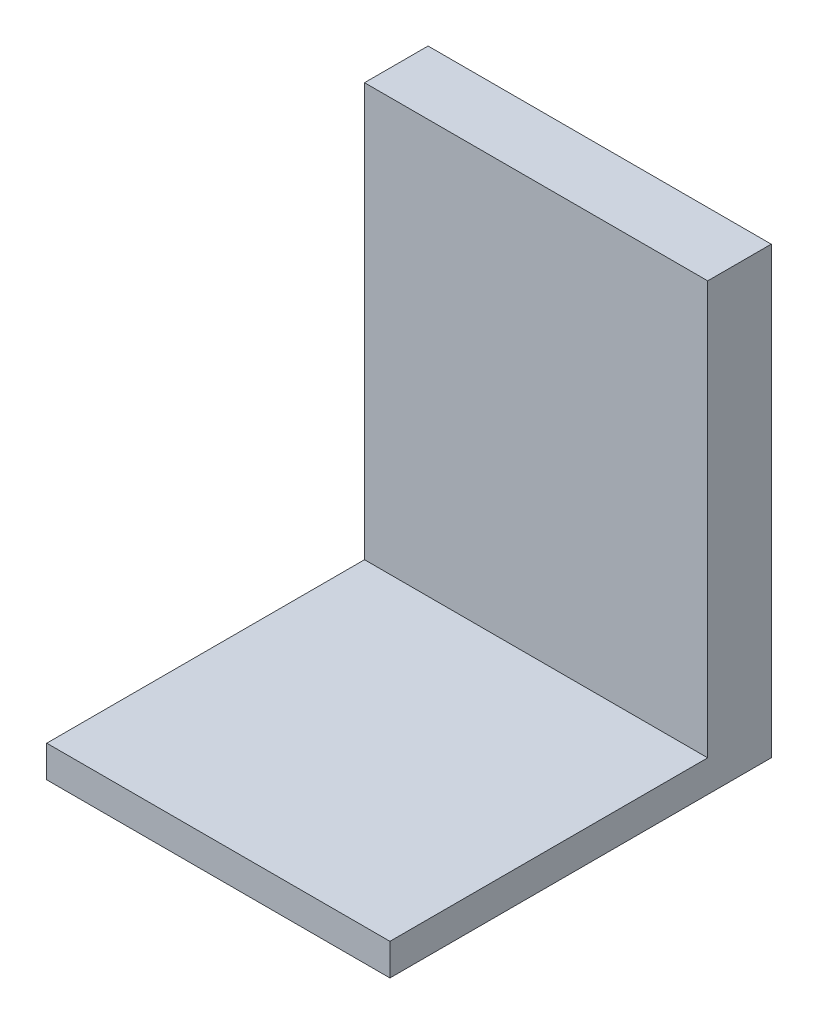
from build123d import *

# Parameters (mm, degrees)
SKETCH1_W                      = 670
SKETCH1_H                      = 120
BOSS_EXTRUDE1_DEPTH            = 530
SKETCH2_W                      = 100
SKETCH2_H                      = 200
SKETCH2_W_2                    = 650
SKETCH2_H_2                    = 250
CUT_EXTRUDE1_DEPTH             = 100
SKETCH3_R                      = 50
CUT_EXTRUDE2_DEPTH             = 260
F_12_0_12_DIAMETER_HOLE2_D     = 12
F_12_0_12_DIAMETER_HOLE2_DEPTH = 30
F_12_0_12_DIAMETER_HOLE2_TIP   = 3.605163714
SKETCH8_W                      = 650
SKETCH8_H                      = 50
BOSS_EXTRUDE2_DEPTH            = 5
SKETCH9_W                      = 10
SKETCH9_H                      = 250
CUT_EXTRUDE3_DEPTH             = 717
CUT_EXTRUDE4_DEPTH             = 5
SKETCH11_W                     = 10
SKETCH11_H                     = 100
BOSS_EXTRUDE3_DEPTH            = 78
BOSS_EXTRUDE3_2_DEPTH          = 78
BOSS_EXTRUDE3_3_DEPTH          = 78
SKETCH12_W                     = 20
SKETCH12_H                     = 30
CUT_EXTRUDE5_DEPTH             = 80
SKETCH15_W                     = 30
SKETCH15_H                     = 23.536156656
SKETCH15_H_2                   = 28.986603691
CUT_EXTRUDE7_DEPTH             = 35
SHELL1_T                       = -3
SKETCH16_W                     = 14
SKETCH16_H                     = 14
CUT_EXTRUDE8_DEPTH             = 35
SKETCH17_W                     = 5.729882812
SKETCH17_H                     = 17.428393554
SKETCH17_W_2                   = 13.369726562
SKETCH17_H_2                   = 3.342431641
BOSS_EXTRUDE4_DEPTH            = 5
CUT_EXTRUDE10_DEPTH            = 863.670273187
CUT_EXTRUDE10_DEPTH_BACK       = 863.670273187
SKETCH18_W                     = 670
SKETCH18_H                     = 250
CUT_EXTRUDE12_DEPTH            = 734.007503372
CUT_EXTRUDE12_DEPTH_BACK       = 734.007503372
SKETCH19_W                     = 440
SKETCH19_H                     = 280
SKETCH20_W                     = 210.918945895
SKETCH20_H                     = 296.400973443
CUT_EXTRUDE14_DEPTH            = 156
CUT_EXTRUDE15_DEPTH            = 376.898922584
CUT_EXTRUDE15_DEPTH_BACK       = 376.898922584
SKETCH21_W                     = 108
SKETCH21_H                     = 140


with BuildPart() as part:
    # Sketch1 → Boss-Extrude1 (new body)
    with BuildSketch(Plane(origin=(0, 0, 0), x_dir=(1, 0, 0), z_dir=(0, 1, 0))):
        with Locations((335, 60)):
            Rectangle(SKETCH1_W, SKETCH1_H)
    extrude(amount=BOSS_EXTRUDE1_DEPTH)

    # Sketch2 → Cut-Extrude1 (cut)
    with BuildSketch(Plane.XY):
        with Locations((60, 380)):
            Rectangle(SKETCH2_W, SKETCH2_H)
        with Locations((170, 380)):
            Rectangle(SKETCH2_W, SKETCH2_H)
        with Locations((280, 380)):
            Rectangle(SKETCH2_W, SKETCH2_H)
        with Locations((390, 380)):
            Rectangle(SKETCH2_W, SKETCH2_H)
        with Locations((500, 380)):
            Rectangle(SKETCH2_W, SKETCH2_H)
        with Locations((610, 380)):
            Rectangle(SKETCH2_W, SKETCH2_H)
        with Locations((335, 135)):
            Rectangle(SKETCH2_W_2, SKETCH2_H_2)
    extrude(amount=-CUT_EXTRUDE1_DEPTH, mode=Mode.SUBTRACT)

    # Sketch3 → Cut-Extrude2 (cut)
    with BuildSketch(Plane(origin=(0, 530, 0), x_dir=(1, 0, 0), z_dir=(0, 1, 0))):
        with Locations(Location((60, 60, 0), (0, 0, 270))):
            Circle(SKETCH3_R)
        with Locations(Location((170, 60, 0), (0, 0, 270))):
            Circle(SKETCH3_R)
        with Locations(Location((280, 60, 0), (0, 0, 270))):
            Circle(SKETCH3_R)
        with Locations(Location((390, 60, 0), (0, 0, 270))):
            Circle(SKETCH3_R)
        with Locations(Location((500, 60, 0), (0, 0, 270))):
            Circle(SKETCH3_R)
        with Locations(Location((610, 60, 0), (0, 0, 270))):
            Circle(SKETCH3_R)
    extrude(amount=-CUT_EXTRUDE2_DEPTH, mode=Mode.SUBTRACT)

    # Ø12.0 (12) Diameter Hole2
    with Locations(Plane(origin=(59.704642413, 270, -102.411697903), x_dir=(0, 0, 1), z_dir=(0, 1, 0))):
        with Locations((0, 0), (-0.195888006, 111.8520513), (0.014838595, 221.167624818), (-0.341843303, 331.364008353), (0.657723149, 441.008646429), (1.288998006, 549.811854685)):
            Hole(F_12_0_12_DIAMETER_HOLE2_D / 2, depth=F_12_0_12_DIAMETER_HOLE2_DEPTH)
            with Locations((0, 0, -(F_12_0_12_DIAMETER_HOLE2_DEPTH + F_12_0_12_DIAMETER_HOLE2_TIP / 2))):  # 118° drill point
                Cone(0, F_12_0_12_DIAMETER_HOLE2_D / 2, F_12_0_12_DIAMETER_HOLE2_TIP, mode=Mode.SUBTRACT)

    # Sketch8 → Boss-Extrude2 (add)
    with BuildSketch(Plane.XY):
        with Locations((335, 305)):
            Rectangle(SKETCH8_W, SKETCH8_H)
    extrude(amount=-BOSS_EXTRUDE2_DEPTH)

    # Sketch9 → Cut-Extrude3 (cut)
    with BuildSketch(Plane(origin=(670, 0, 0), x_dir=(0, 0, -1), z_dir=(1, 0, 0))):
        with Locations((15, 135)):
            Rectangle(SKETCH9_W, SKETCH9_H)
    extrude(amount=-CUT_EXTRUDE3_DEPTH, mode=Mode.SUBTRACT)

    # Sketch10 → Cut-Extrude4 (cut)
    with BuildSketch(Plane(origin=(0, 10, 0), x_dir=(1, 0, 0), z_dir=(0, 1, 0))):
        Polygon((365, 61.943560596), (350, 87.924322709), (320, 87.924322709), (305, 61.943560596), (320, 35.962798482), (350, 35.962798482), align=None)
    extrude(amount=-CUT_EXTRUDE4_DEPTH, mode=Mode.SUBTRACT)

    # Sketch12 → Cut-Extrude5 (cut)
    with BuildSketch(Plane.XY.offset(-100)):
        with Locations((85.198613037, 245)):
            Rectangle(SKETCH12_W, SKETCH12_H)
        with Locations((195.198613037, 245)):
            Rectangle(SKETCH12_W, SKETCH12_H)
        with Locations((305.198613037, 245)):
            Rectangle(SKETCH12_W, SKETCH12_H)
        with Locations((415.198613037, 245)):
            Rectangle(SKETCH12_W, SKETCH12_H)
        with Locations((525.198613037, 245)):
            Rectangle(SKETCH12_W, SKETCH12_H)
        with Locations((635.198613037, 245)):
            Rectangle(SKETCH12_W, SKETCH12_H)
    extrude(amount=-CUT_EXTRUDE5_DEPTH, mode=Mode.SUBTRACT)

    # Sketch17 → Boss-Extrude4 (add)
    # profile 1 of 9: a face of its own
    with BuildSketch(Plane.XY):
        with BuildLine():
            Line((527.508830928, 289.835452458), (527.508830928, 307.263846012))
            Line((527.508830928, 307.263846012), (534.861434459, 307.263846012))
            add(Edge.make_bspline(
                [(534.861434459, 307.263846012), (535.181337774, 307.258256848), (535.803061116, 307.24739446), (536.703508491, 307.139069344), (537.544992916, 306.975202489), (538.325061607, 306.737496792), (539.040841948, 306.426020155), (539.698044515, 306.051894954), (540.290333057, 305.605079277), (540.822348212, 305.090232636), (541.284521701, 304.502523111), (541.692171296, 303.852565801), (542.030284458, 303.129762281), (542.309377095, 302.341316546), (542.5243908, 301.484161689), (542.679660381, 300.560045938), (542.773357357, 299.567500804), (542.783368073, 298.883107022), (542.788518428, 298.530997273)],
                knots=[0, 0, 0, 0, 1.135059408, 2.20595691, 3.214417064, 4.174978569, 5.094187092, 5.980001006, 6.853065862, 7.720814779, 8.600404634, 9.50058483, 10.438414914, 11.426825708, 12.465239141, 13.571113463, 14.750376389, 16, 16, 16, 16], degree=3))
            add(Edge.make_bspline(
                [(542.788518428, 298.530997273), (542.781740751, 298.180151665), (542.768592871, 297.499553336), (542.676885992, 296.511518461), (542.516733301, 295.591080531), (542.296748778, 294.736450427), (542.003051046, 293.953120444), (541.654236167, 293.233205539), (541.233025793, 292.585291498), (540.753136904, 292.000029304), (540.204772188, 291.484681411), (539.587651059, 291.044279297), (538.910779309, 290.668464036), (538.169670382, 290.361903209), (537.364073889, 290.124869172), (536.495133477, 289.954199984), (535.562644449, 289.853487388), (534.920131033, 289.841584621), (534.58911581, 289.835452458)],
                knots=[0, 0, 0, 0, 1.228418252, 2.382983832, 3.470276728, 4.496757894, 5.468023682, 6.394867725, 7.292157164, 8.167372942, 9.039072913, 9.918728341, 10.815246345, 11.744296628, 12.720973084, 13.750736166, 14.841206188, 16, 16, 16, 16], degree=3))
            Line((534.58911581, 289.835452458), (527.508830928, 289.835452458))
        make_face()
        with BuildLine():
            Line((533.238713741, 291.745413395), (534.048208904, 291.745413395))
            add(Edge.make_bspline(
                [(534.048208904, 291.745413395), (534.172894012, 291.749291978), (534.413033311, 291.756761998), (534.758676231, 291.825976613), (535.075745017, 291.938271137), (535.365749176, 292.094802589), (535.623404602, 292.300450923), (535.848862806, 292.551404902), (536.04776914, 292.844737637), (536.217685755, 293.190205032), (536.364284647, 293.596533622), (536.481764702, 294.076367921), (536.592118304, 294.630928744), (536.673672739, 295.265507643), (536.740044562, 295.978448886), (536.788346679, 296.768428292), (536.812018936, 297.636801208), (536.817188964, 298.241258393), (536.819890499, 298.55711002)],
                knots=[0, 0, 0, 0, 0.728710832, 1.403472396, 2.052289494, 2.690292559, 3.321919393, 3.970736491, 4.656696891, 5.388631723, 6.217040872, 7.17856157, 8.275589967, 9.523440737, 10.918935818, 12.463926104, 14.152268318, 16, 16, 16, 16], degree=3))
            add(Edge.make_bspline(
                [(536.819890499, 298.55711002), (536.8171426, 298.871715251), (536.811863063, 299.476166083), (536.7886758, 300.343334385), (536.739579947, 301.133216935), (536.674703848, 301.843934916), (536.589660404, 302.476324031), (536.488366458, 303.031681737), (536.362441588, 303.507627045), (536.222158727, 303.914921549), (536.050140993, 304.256514038), (535.858357073, 304.554097881), (535.62547107, 304.79746827), (535.36991257, 305.004888479), (535.079348843, 305.160875844), (534.761320266, 305.273944358), (534.414185903, 305.34216807), (534.172870641, 305.349893944), (534.048208904, 305.353885075)],
                knots=[0, 0, 0, 0, 1.842836665, 3.540640921, 5.080358154, 6.47765669, 7.719902824, 8.816971715, 9.781579111, 10.601733135, 11.334613876, 12.017393917, 12.666641099, 13.29908421, 13.937911793, 14.587567384, 15.270347425, 16, 16, 16, 16], degree=3))
            Line((534.048208904, 305.353885075), (533.238713741, 305.353885075))
            Line((533.238713741, 305.353885075), (533.238713741, 291.745413395))
        make_face(mode=Mode.SUBTRACT)
    # profile 2 of 9: a face of its own
    with BuildSketch(Plane.XY):
        with Locations((547.563420772, 298.549649235)):
            Rectangle(SKETCH17_W, SKETCH17_H)
    # profile 3 of 9: a face of its own
    with BuildSketch(Plane.XY):
        Polygon((564.514324092, 307.263846012), (564.514324092, 305.115139958), (558.545696163, 305.115139958), (558.545696163, 299.862747379), (563.559343624, 299.862747379), (563.559343624, 297.714041325), (558.545696163, 297.714041325), (558.545696163, 289.835452458), (552.81581335, 289.835452458), (552.81581335, 307.263846012), align=None)
    # profile 4 of 9: a face of its own
    with BuildSketch(Plane.XY):
        Polygon((577.645305538, 307.263846012), (577.645305538, 305.115139958), (571.676677608, 305.115139958), (571.676677608, 299.862747379), (576.690325069, 299.862747379), (576.690325069, 297.714041325), (571.676677608, 297.714041325), (571.676677608, 289.835452458), (565.946794795, 289.835452458), (565.946794795, 307.263846012), align=None)
    # profile 5 of 9: a face of its own
    with BuildSketch(Plane.XY):
        with Locations((584.330168819, 287.448001286)):
            Rectangle(SKETCH17_W_2, SKETCH17_H_2)
    # profile 6 of 9: a face of its own
    with BuildSketch(Plane.XY):
        with BuildLine():
            Line((605.578484249, 307.263846012), (605.578484249, 295.602639195))
            add(Edge.make_bspline(
                [(605.578484249, 295.602639195), (605.574209777, 295.35989389), (605.565919345, 294.889083964), (605.480877158, 294.20653885), (605.349958188, 293.569747554), (605.15926554, 292.978838165), (604.911867049, 292.436847071), (604.616163877, 291.936663973), (604.260702644, 291.487723021), (603.847299908, 291.08966617), (603.386881991, 290.731670113), (602.867295001, 290.425440037), (602.293741958, 290.168488385), (601.66690529, 289.960990771), (600.988052682, 289.797299786), (600.254912883, 289.679078851), (599.467035781, 289.60781007), (598.923618241, 289.60048219), (598.643684673, 289.59670734)],
                knots=[0, 0, 0, 0, 1.108173197, 2.149326602, 3.136215123, 4.073726706, 4.978516626, 5.852185058, 6.72141202, 7.584905625, 8.467554395, 9.379216169, 10.332422268, 11.332766067, 12.390653242, 13.518530507, 14.721707419, 16, 16, 16, 16], degree=3))
            add(Edge.make_bspline(
                [(598.643684673, 289.59670734), (598.373688491, 289.600411437), (597.851346557, 289.607577482), (597.093280473, 289.679448684), (596.387523889, 289.797736542), (595.733050135, 289.960122315), (595.130189942, 290.169220301), (594.579048171, 290.42623041), (594.078350789, 290.732835498), (593.633858028, 291.090104794), (593.234289459, 291.486851767), (592.899913678, 291.940746827), (592.609043638, 292.435866034), (592.375223767, 292.980322997), (592.191754821, 293.570441519), (592.063541006, 294.20666921), (591.983676196, 294.889343196), (591.974661767, 295.359932437), (591.970012569, 295.602639195)],
                knots=[0, 0, 0, 0, 1.258901956, 2.435505865, 3.547148904, 4.59359074, 5.576649289, 6.5183682, 7.424469602, 8.307507093, 9.172751023, 10.042627298, 10.928839176, 11.845659241, 12.799442865, 13.80597989, 14.868432463, 16, 16, 16, 16], degree=3))
            Line((591.970012569, 295.602639195), (591.970012569, 307.263846012))
            Line((591.970012569, 307.263846012), (597.699895381, 307.263846012))
            Line((597.699895381, 307.263846012), (597.699895381, 295.457153889))
            add(Edge.make_bspline(
                [(597.699895381, 295.457153889), (597.700816195, 295.287996189), (597.702584578, 294.963135903), (597.729908723, 294.499051493), (597.768241004, 294.079064133), (597.828226169, 293.705517832), (597.90066041, 293.377063412), (597.989882091, 293.09281535), (598.094998068, 292.852496478), (598.225239063, 292.654232043), (598.380826623, 292.495135011), (598.55368342, 292.353231761), (598.757556996, 292.238543846), (598.987648905, 292.146224908), (599.243380948, 292.070549638), (599.526120553, 292.020376099), (599.83553351, 291.990763905), (600.049971942, 291.986424568), (600.161954402, 291.984158512)],
                knots=[0, 0, 0, 0, 1.622370975, 3.115695595, 4.458049099, 5.666011203, 6.742434742, 7.681714947, 8.519814998, 9.250928664, 9.942747364, 10.646898194, 11.389596108, 12.175933929, 13.021386247, 13.943159715, 14.925891993, 16, 16, 16, 16], degree=3))
            add(Edge.make_bspline(
                [(600.161954402, 291.984158512), (600.283927219, 291.987190593), (600.521124756, 291.993087005), (600.86597014, 292.03390861), (601.187714881, 292.103380086), (601.484890424, 292.205377303), (601.758665297, 292.332852529), (602.012761516, 292.484567923), (602.236391413, 292.674631152), (602.439076761, 292.888441291), (602.620738276, 293.128529789), (602.771757722, 293.399928575), (602.905501548, 293.697121508), (603.005823683, 294.025060118), (603.089837826, 294.379999499), (603.146989706, 294.763086929), (603.186210275, 295.174074524), (603.189394751, 295.457053988), (603.191033077, 295.602639195)],
                knots=[0, 0, 0, 0, 1.083870311, 2.107775948, 3.08105344, 4.003637981, 4.893545291, 5.761570557, 6.624657808, 7.49233129, 8.376387281, 9.291996285, 10.246843261, 11.267344133, 12.334180325, 13.486053461, 14.706643157, 16, 16, 16, 16], degree=3))
            Line((603.191033077, 295.602639195), (603.191033077, 307.263846012))
            Line((603.191033077, 307.263846012), (605.578484249, 307.263846012))
        make_face()
    # profile 7 of 9: a face of its own
    with BuildSketch(Plane.XY):
        with BuildLine():
            Line((619.731593227, 302.015183827), (616.739818477, 301.526502415))
            add(Edge.make_bspline(
                [(616.739818477, 301.526502415), (616.748849224, 301.670726223), (616.765660669, 301.939210177), (616.78429066, 302.312269209), (616.796668381, 302.625642376), (616.798628236, 302.814722915), (616.799504756, 302.899286839)],
                knots=[0, 0, 0, 0, 1.261802504, 2.348944521, 3.261585937, 4, 4, 4, 4], degree=3))
            add(Edge.make_bspline(
                [(616.799504756, 302.899286839), (616.798306068, 303.007660677), (616.795968139, 303.219033721), (616.750451916, 303.523894877), (616.694806916, 303.811547356), (616.604352699, 304.076787391), (616.488181329, 304.320314265), (616.348943917, 304.543955606), (616.184187178, 304.745078709), (615.995833421, 304.928129987), (615.778009957, 305.083200131), (615.536269472, 305.218702836), (615.269765326, 305.333844758), (614.978065514, 305.431346685), (614.660683072, 305.504624438), (614.319025281, 305.556776695), (613.952471696, 305.585673441), (613.699597795, 305.590260771), (613.568984889, 305.592630192)],
                knots=[0, 0, 0, 0, 1.079280541, 2.105035848, 3.067950317, 3.99715044, 4.889989748, 5.753421302, 6.617030865, 7.476358039, 8.364190572, 9.274590025, 10.235106994, 11.254473582, 12.337095886, 13.478601727, 14.697662529, 16, 16, 16, 16], degree=3))
            add(Edge.make_bspline(
                [(613.568984889, 305.592630192), (613.391954632, 305.58912286), (613.059112606, 305.582528579), (612.595688488, 305.495339748), (612.198743126, 305.361419257), (611.87165349, 305.163811893), (611.613188167, 304.909795747), (611.433841092, 304.593316589), (611.323009072, 304.224665915), (611.313400221, 303.959558324), (611.308367061, 303.820693775)],
                knots=[0, 0, 0, 0, 1.294917039, 2.43462794, 3.440028966, 4.347597256, 5.210608309, 6.06356377, 6.985685997, 8, 8, 8, 8], degree=3))
            add(Edge.make_bspline(
                [(611.308367061, 303.820693775), (611.317562032, 303.705133219), (611.336106628, 303.472068433), (611.47315858, 303.132808312), (611.695999602, 302.811560885), (612.009295906, 302.510664216), (612.404107796, 302.221967273), (612.884407504, 301.948533431), (613.450813789, 301.688189695), (613.862519081, 301.536023727), (614.080048656, 301.455624958)],
                knots=[0, 0, 0, 0, 0.716839541, 1.445735977, 2.240793036, 3.131329288, 4.131129903, 5.273471266, 6.559404876, 8, 8, 8, 8], degree=3))
            add(Edge.make_bspline(
                [(614.080048656, 301.455624958), (614.335934702, 301.364918412), (614.834564244, 301.188164095), (615.547657928, 300.88707802), (616.213068388, 300.5749594), (616.829579094, 300.246613346), (617.397833174, 299.90520698), (617.914851624, 299.544556457), (618.386199073, 299.173962102), (618.807001026, 298.783874588), (619.177995113, 298.378100064), (619.4958685, 297.952745357), (619.771807525, 297.51723103), (619.991113975, 297.061458502), (620.169645242, 296.594624218), (620.292698657, 296.11024444), (620.364288243, 295.609761088), (620.37516617, 295.270864226), (620.380681514, 295.099036213)],
                knots=[0, 0, 0, 0, 1.359488612, 2.649152603, 3.874964776, 5.039588756, 6.146130126, 7.193090393, 8.194917302, 9.146793662, 10.063845301, 10.944476293, 11.803344532, 12.641736646, 13.473440096, 14.302714936, 15.139439897, 16, 16, 16, 16], degree=3))
            add(Edge.make_bspline(
                [(620.380681514, 295.099036213), (620.374476075, 294.902306495), (620.362285176, 294.515820995), (620.280160209, 293.948630617), (620.138011896, 293.409496554), (619.938489338, 292.895972278), (619.681049879, 292.411946655), (619.366518754, 291.954381076), (618.996510229, 291.525099427), (618.5710008, 291.128381035), (618.102222518, 290.765302239), (617.587803957, 290.450854345), (617.034458515, 290.187092261), (616.444107988, 289.968993032), (615.81453624, 289.801373099), (615.145337453, 289.685291013), (614.438790193, 289.606619894), (613.954683001, 289.600062276), (613.70700941, 289.59670734)],
                knots=[0, 0, 0, 0, 0.972121714, 1.909782367, 2.824924061, 3.721832975, 4.62620438, 5.527836938, 6.46026819, 7.421000932, 8.398101015, 9.385579713, 10.394244048, 11.422703992, 12.491421888, 13.608778581, 14.776629625, 16, 16, 16, 16], degree=3))
            add(Edge.make_bspline(
                [(613.70700941, 289.59670734), (613.445745367, 289.599650312), (612.939893069, 289.605348413), (612.207608113, 289.66709241), (611.525297432, 289.760984454), (610.893395078, 289.899706116), (610.309273131, 290.072394336), (609.776099392, 290.288320955), (609.295310255, 290.547303481), (608.863217672, 290.843007892), (608.478306623, 291.175775461), (608.148120946, 291.551766865), (607.86942369, 291.967163224), (607.639947144, 292.421521488), (607.466477665, 292.917583541), (607.339164663, 293.449829748), (607.264537999, 294.021332449), (607.254747521, 294.414908557), (607.249700069, 294.617815586)],
                knots=[0, 0, 0, 0, 1.342201143, 2.598733168, 3.773451092, 4.878874364, 5.91991243, 6.900006476, 7.829142054, 8.72062616, 9.585588575, 10.436728592, 11.283829734, 12.149664931, 13.044964919, 13.977937424, 14.957531465, 16, 16, 16, 16], degree=3))
            add(Edge.make_bspline(
                [(607.249700069, 294.617815586), (607.250803815, 294.692425759), (607.253213998, 294.855347393), (607.260452266, 295.122772538), (607.275636683, 295.433682216), (607.29037174, 295.656130545), (607.298195171, 295.774237248)],
                knots=[0, 0, 0, 0, 0.773500207, 1.689044709, 2.77302154, 4, 4, 4, 4], degree=3))
            Line((607.298195171, 295.774237248), (610.36457777, 296.337526509))
            add(Edge.make_bspline(
                [(610.36457777, 296.337526509), (610.326952988, 296.136337493), (610.255606535, 295.754830366), (610.178678473, 295.21219969), (610.124206629, 294.733311493), (610.11767002, 294.435147371), (610.114641475, 294.297001835)],
                knots=[0, 0, 0, 0, 1.192988372, 2.262218769, 3.194850416, 4, 4, 4, 4], degree=3))
            add(Edge.make_bspline(
                [(610.114641475, 294.297001835), (610.116191817, 294.183708768), (610.119182568, 293.965156219), (610.159053378, 293.648552813), (610.215988606, 293.352999663), (610.302906772, 293.079707227), (610.411206928, 292.826307836), (610.544682453, 292.59538211), (610.704385489, 292.386485019), (610.887496571, 292.200099922), (611.094689168, 292.033628705), (611.327456494, 291.892756696), (611.58347653, 291.771733922), (611.864681562, 291.677479524), (612.167961721, 291.596080628), (612.497219749, 291.548235723), (612.849461228, 291.512043782), (613.092629543, 291.508500084), (613.218327999, 291.506668278)],
                knots=[0, 0, 0, 0, 1.135776692, 2.191015738, 3.19649269, 4.151244236, 5.061952528, 5.956281389, 6.819534407, 7.692823504, 8.571441916, 9.478554956, 10.416037156, 11.406231466, 12.450054172, 13.561596327, 14.739541482, 16, 16, 16, 16], degree=3))
            add(Edge.make_bspline(
                [(613.218327999, 291.506668278), (613.423996012, 291.510791273), (613.810619321, 291.518541853), (614.349272542, 291.616708407), (614.810575885, 291.768742445), (615.189785268, 291.991387532), (615.490778961, 292.278756613), (615.698005174, 292.637320004), (615.824813318, 293.05638326), (615.837728413, 293.355975238), (615.844524288, 293.513619419)],
                knots=[0, 0, 0, 0, 1.308765556, 2.460272085, 3.475015317, 4.388076298, 5.239673503, 6.095681635, 6.997954785, 8, 8, 8, 8], degree=3))
            add(Edge.make_bspline(
                [(615.844524288, 293.513619419), (615.833808824, 293.638242951), (615.811807312, 293.894126055), (615.644884004, 294.264515838), (615.382382362, 294.620631473), (615.016807277, 294.962984909), (614.551376589, 295.293471235), (613.986957743, 295.616730224), (613.322148235, 295.933112033), (612.83677959, 296.119639164), (612.580430889, 296.21815395)],
                knots=[0, 0, 0, 0, 0.667930748, 1.371427933, 2.146459016, 3.034714139, 4.04893387, 5.207327294, 6.525042705, 8, 8, 8, 8], degree=3))
            add(Edge.make_bspline(
                [(612.580430889, 296.21815395), (612.374354345, 296.29679374), (611.970646869, 296.450850434), (611.394079385, 296.713586304), (610.853066711, 296.987016804), (610.357486361, 297.288235735), (609.896382561, 297.599610528), (609.477036946, 297.932256792), (609.09841673, 298.284556341), (608.758710772, 298.653375077), (608.457302107, 299.038989264), (608.199448649, 299.444659231), (607.977533299, 299.866789834), (607.798609588, 300.308107488), (607.65975715, 300.767821241), (607.559616231, 301.244439392), (607.497905054, 301.739995674), (607.491630423, 302.075933546), (607.488445186, 302.246468159)],
                knots=[0, 0, 0, 0, 1.249558333, 2.447906163, 3.58867143, 4.682264114, 5.731748367, 6.739728761, 7.711906036, 8.659384707, 9.578321416, 10.481344598, 11.379544271, 12.277135726, 13.175418307, 14.097160112, 15.034047388, 16, 16, 16, 16], degree=3))
            add(Edge.make_bspline(
                [(607.488445186, 302.246468159), (607.49282555, 302.439538736), (607.501402184, 302.817565692), (607.587451154, 303.36980586), (607.719291893, 303.894921371), (607.910558542, 304.389343064), (608.156192894, 304.852853762), (608.453187669, 305.288766511), (608.804241719, 305.697593471), (609.213503754, 306.066686531), (609.657214714, 306.407618241), (610.14376173, 306.697651931), (610.658716537, 306.950861947), (611.210636666, 307.148827868), (611.791820619, 307.313252612), (612.408080529, 307.421140415), (613.056315391, 307.490701612), (613.499160755, 307.498567824), (613.725661373, 307.502591129)],
                knots=[0, 0, 0, 0, 1.01033566, 1.978209831, 2.919499157, 3.840961976, 4.746855014, 5.660740114, 6.597989116, 7.56120833, 8.541877795, 9.523498025, 10.522416858, 11.542172371, 12.589598349, 13.681636521, 14.814234488, 16, 16, 16, 16], degree=3))
            add(Edge.make_bspline(
                [(613.725661373, 307.502591129), (613.968269855, 307.498219033), (614.438190994, 307.489750488), (615.120391152, 307.426787419), (615.755073228, 307.319142339), (616.345153155, 307.171557286), (616.887304575, 306.977590666), (617.384933999, 306.742393454), (617.834452216, 306.46201507), (618.236961315, 306.139451502), (618.593086714, 305.773322851), (618.897467704, 305.361641069), (619.158701245, 304.909408454), (619.366684143, 304.412232174), (619.529870326, 303.873247147), (619.649133834, 303.29158184), (619.720420497, 302.667301443), (619.72779778, 302.236712324), (619.731593227, 302.015183827)],
                knots=[0, 0, 0, 0, 1.248314423, 2.417925914, 3.521398822, 4.558068205, 5.543720209, 6.479599284, 7.385061127, 8.263440163, 9.127722873, 10.00561236, 10.891325273, 11.808802823, 12.772251995, 13.784947978, 14.860405143, 16, 16, 16, 16], degree=3))
        make_face()
    # profile 8 of 9: a face of its own
    with BuildSketch(Plane.XY):
        Polygon((633.989153194, 307.263846012), (633.989153194, 305.115139958), (628.020525264, 305.115139958), (628.020525264, 300.340237614), (633.034172725, 300.340237614), (633.034172725, 298.191531559), (628.020525264, 298.191531559), (628.020525264, 291.984158512), (634.944133663, 291.984158512), (634.944133663, 289.835452458), (622.290642452, 289.835452458), (622.290642452, 307.263846012), align=None)
    # profile 9 of 9: a face of its own
    with BuildSketch(Plane.XY):
        with BuildLine():
            Line((636.376604366, 289.835452458), (636.376604366, 307.263846012))
            Line((636.376604366, 307.263846012), (643.990335369, 307.263846012))
            add(Edge.make_bspline(
                [(643.990335369, 307.263846012), (644.237946498, 307.261150834), (644.721600887, 307.25588639), (645.426490561, 307.189203683), (646.094808274, 307.090496236), (646.724915796, 306.949857504), (647.317873659, 306.767252686), (647.871119087, 306.542146), (648.390701058, 306.282329135), (648.864494846, 305.976472528), (649.295093616, 305.642889252), (649.669668547, 305.279483604), (649.990389523, 304.894749072), (650.250664962, 304.483256345), (650.454275633, 304.048690948), (650.59581384, 303.587791605), (650.684089268, 303.104102537), (650.695510601, 302.772834174), (650.701311397, 302.604585835)],
                knots=[0, 0, 0, 0, 1.303269877, 2.545653735, 3.724355284, 4.8584284, 5.941462088, 6.987020715, 8.000098032, 8.995332524, 9.951400474, 10.863507538, 11.737823931, 12.582415999, 13.420128714, 14.25671499, 15.114600608, 16, 16, 16, 16], degree=3))
            add(Edge.make_bspline(
                [(650.701311397, 302.604585835), (650.698282873, 302.472674957), (650.692382063, 302.215658276), (650.651041486, 301.838684287), (650.580643818, 301.480313933), (650.481036683, 301.139915259), (650.347814833, 300.820175594), (650.191279492, 300.517863507), (650.009772227, 300.230553342), (649.788675198, 299.970497982), (649.548268341, 299.722842359), (649.274558803, 299.497116911), (648.974487035, 299.288655528), (648.642526299, 299.104010513), (648.287619671, 298.928055749), (647.899038177, 298.784921972), (647.486819978, 298.644749395), (647.19793098, 298.577036306), (647.049257183, 298.54218845)],
                knots=[0, 0, 0, 0, 1.057156483, 2.059775939, 3.035078039, 3.981068617, 4.897189472, 5.80650904, 6.70770952, 7.613691521, 8.536886357, 9.470937334, 10.45233069, 11.461024139, 12.51295332, 13.623444893, 14.776929983, 16, 16, 16, 16], degree=3))
            add(Edge.make_bspline(
                [(647.049257183, 298.54218845), (647.19164695, 298.499279419), (647.467865022, 298.416041346), (647.856360945, 298.265600017), (648.211652989, 298.111536308), (648.524185739, 297.936781388), (648.807636894, 297.762122504), (649.047122259, 297.564301324), (649.255235567, 297.361673563), (649.425188343, 297.135464734), (649.570253643, 296.882344437), (649.694827156, 296.586596707), (649.815179167, 296.247423665), (649.917667348, 295.859098311), (650.004750555, 295.423699276), (650.088222437, 294.944027189), (650.153853601, 294.416024546), (650.187587341, 294.048412906), (650.2051692, 293.856815525)],
                knots=[0, 0, 0, 0, 1.149282524, 2.229462177, 3.219229774, 4.139917433, 4.995948464, 5.788695735, 6.536448429, 7.236319808, 7.968460079, 8.78645307, 9.713791991, 10.749194692, 11.887975363, 13.146018663, 14.512518948, 16, 16, 16, 16], degree=3))
            add(Edge.make_bspline(
                [(650.2051692, 293.856815525), (650.225980287, 293.627849833), (650.265975604, 293.187817268), (650.348933081, 292.554613589), (650.44386163, 291.974357025), (650.555874504, 291.44528724), (650.681301216, 290.967898855), (650.821280597, 290.540469593), (650.979920039, 290.165788217), (651.10484481, 289.941461656), (651.163880062, 289.835452458)],
                knots=[0, 0, 0, 0, 1.324580516, 2.545615266, 3.678710841, 4.711533017, 5.660403917, 6.521349952, 7.301239649, 8, 8, 8, 8], degree=3))
            Line((651.163880062, 289.835452458), (645.213904094, 289.835452458))
            add(Edge.make_bspline(
                [(645.213904094, 289.835452458), (645.12229736, 290.069847279), (644.935171241, 290.548648246), (644.7595281, 291.319414791), (644.64846922, 292.142514735), (644.635117598, 292.70994511), (644.628232479, 293.002555653)],
                knots=[0, 0, 0, 0, 0.930410518, 1.900560147, 2.917368081, 4, 4, 4, 4], degree=3))
            Line((644.628232479, 293.002555653), (644.605850124, 294.002300831))
            Line((644.605850124, 294.002300831), (644.579737377, 295.266903874))
            add(Edge.make_bspline(
                [(644.579737377, 295.266903874), (644.573694669, 295.477395004), (644.562357007, 295.872330118), (644.469348432, 296.426164013), (644.30178735, 296.894645884), (644.073222546, 297.287223005), (643.766741442, 297.590613479), (643.39104803, 297.804152917), (642.950456912, 297.93396284), (642.634664848, 297.946292392), (642.468335247, 297.952786442)],
                knots=[0, 0, 0, 0, 1.295300309, 2.430314163, 3.439929415, 4.342995669, 5.203512789, 6.060756153, 6.978588463, 8, 8, 8, 8], degree=3))
            Line((642.468335247, 297.952786442), (642.106487178, 297.952786442))
            Line((642.106487178, 297.952786442), (642.106487178, 289.835452458))
            Line((642.106487178, 289.835452458), (636.376604366, 289.835452458))
        make_face()
        with BuildLine():
            Line((642.106487178, 299.862747379), (642.617550945, 299.862747379))
            add(Edge.make_bspline(
                [(642.617550945, 299.862747379), (642.722054451, 299.865172716), (642.925280724, 299.869889229), (643.220054897, 299.898289891), (643.494111408, 299.951809873), (643.749840966, 300.021017819), (643.984372137, 300.114851792), (644.200147241, 300.225818296), (644.391160406, 300.362685327), (644.565327067, 300.516342321), (644.718148635, 300.691986294), (644.850351299, 300.889034217), (644.961199162, 301.106225057), (645.056078491, 301.342818683), (645.125883912, 301.600830857), (645.173262731, 301.879472914), (645.203404658, 302.177423605), (645.207875435, 302.383174491), (645.210173702, 302.488943669)],
                knots=[0, 0, 0, 0, 1.184986479, 2.304423995, 3.352332712, 4.347714965, 5.303263624, 6.211353909, 7.091434645, 7.960150225, 8.839440182, 9.723126897, 10.64371617, 11.599264829, 12.608232147, 13.667459739, 14.800924404, 16, 16, 16, 16], degree=3))
            add(Edge.make_bspline(
                [(645.210173702, 302.488943669), (645.207875435, 302.594712847), (645.203404658, 302.800463732), (645.173262731, 303.098414423), (645.125883912, 303.37705648), (645.056078491, 303.635068654), (644.961199162, 303.87166228), (644.850351299, 304.08885312), (644.718148635, 304.285901043), (644.565327067, 304.461545017), (644.391160406, 304.61520201), (644.200147241, 304.752069041), (643.984372137, 304.863035546), (643.749840966, 304.956869518), (643.494111408, 305.026077464), (643.220054897, 305.079597446), (642.925280724, 305.107998108), (642.722054451, 305.112714621), (642.617550945, 305.115139958)],
                knots=[0, 0, 0, 0, 1.199075596, 2.332540261, 3.391767853, 4.400735171, 5.35628383, 6.276873103, 7.160559818, 8.039849775, 8.908565355, 9.788646091, 10.696736376, 11.652285035, 12.647667288, 13.695576005, 14.815013521, 16, 16, 16, 16], degree=3))
            Line((642.617550945, 305.115139958), (642.106487178, 305.115139958))
            Line((642.106487178, 305.115139958), (642.106487178, 299.862747379))
        make_face(mode=Mode.SUBTRACT)
    extrude(amount=BOSS_EXTRUDE4_DEPTH)

    # Sketch18 → Cut-Extrude10 (cut, two sides: drawn at the far end of the back side and taken through both)
    with BuildSketch(Plane.XY.offset(-CUT_EXTRUDE10_DEPTH_BACK)):
        with Locations((335, 405)):
            Rectangle(SKETCH18_W, SKETCH18_H)
    extrude(amount=CUT_EXTRUDE10_DEPTH + CUT_EXTRUDE10_DEPTH_BACK, mode=Mode.SUBTRACT)

    # Sketch19 → Cut-Extrude12 (cut, two sides: drawn at the far end of the back side and taken through both)
    with BuildSketch(Plane.XY.offset(-100).offset(-CUT_EXTRUDE12_DEPTH_BACK)):
        with Locations((450, 140)):
            Rectangle(SKETCH19_W, SKETCH19_H)
    extrude(amount=CUT_EXTRUDE12_DEPTH + CUT_EXTRUDE12_DEPTH_BACK, mode=Mode.SUBTRACT)

    # Sketch20 → Cut-Extrude14 (cut)
    with BuildSketch(Plane(origin=(0, 0, -120), x_dir=(-1, 0, 0), z_dir=(0, 0, -1))):
        with Locations((-16.540527053, 148.200486721)):
            Rectangle(SKETCH20_W, SKETCH20_H)
    extrude(amount=-CUT_EXTRUDE14_DEPTH, mode=Mode.SUBTRACT)

    # Sketch21 → Cut-Extrude15 (cut, two sides: drawn at the far end of the back side and taken through both)
    with BuildSketch(Plane.XY.offset(-100).offset(-CUT_EXTRUDE15_DEPTH_BACK)):
        with Locations((176, 210)):
            Rectangle(SKETCH21_W, SKETCH21_H)
    extrude(amount=CUT_EXTRUDE15_DEPTH + CUT_EXTRUDE15_DEPTH_BACK, mode=Mode.SUBTRACT)


with BuildPart() as body_2:
    # Sketch11 → Boss-Extrude3 (new body)
    with BuildSketch(Plane.XY.offset(-100)):
        with Locations((255, 60)):
            Rectangle(SKETCH11_W, SKETCH11_H)
    extrude(amount=BOSS_EXTRUDE3_DEPTH)


with BuildPart() as body_3:
    # Sketch11 → Boss-Extrude3 2 (new body)
    with BuildSketch(Plane.XY.offset(-100)):
        with Locations((415, 60)):
            Rectangle(SKETCH11_W, SKETCH11_H)
    extrude(amount=BOSS_EXTRUDE3_2_DEPTH)


with BuildPart() as body_4:
    # Sketch11 → Boss-Extrude3 3 (new body)
    with BuildSketch(Plane.XY.offset(-100)):
        Polygon((25, 198.45686471), (325, 145.558770497), (325, 122.01775856), (345, 122.01775856), (345, 145.558770497), (645, 198.45686471), align=None)
    extrude(amount=BOSS_EXTRUDE3_3_DEPTH)

    # Sketch15 → Cut-Extrude7 (cut)
    with BuildSketch(Plane(origin=(345, 0, 0), x_dir=(0, 0, -1), z_dir=(1, 0, 0))):
        with Locations((35, 133.231921672)):
            Rectangle(SKETCH15_W, SKETCH15_H)
        with Locations((85, 130.506698154)):
            Rectangle(SKETCH15_W, SKETCH15_H_2)
    extrude(amount=-CUT_EXTRUDE7_DEPTH, mode=Mode.SUBTRACT)

    # Shell1
    shell1_openings = [body_4.faces().sort_by_distance(p)[0] for p in [
        (335, 198.45686471, -61),
    ]]
    offset(amount=SHELL1_T, openings=shell1_openings, kind=Kind.INTERSECTION)

    # Sketch16 → Cut-Extrude8 (cut)
    with BuildSketch(Plane.XZ.offset(-122.01775856)):
        with Locations((335, -60)):
            Rectangle(SKETCH16_W, SKETCH16_H)
    extrude(amount=-CUT_EXTRUDE8_DEPTH, mode=Mode.SUBTRACT)


solid = part.part
